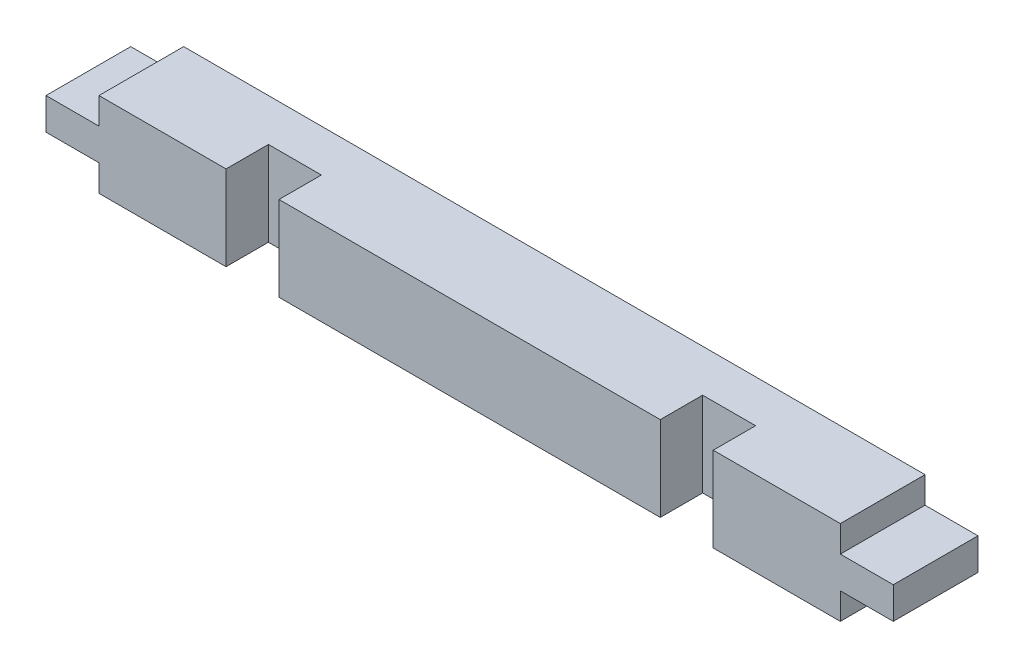
from build123d import *

# Parameters (mm, degrees)
BOSS_EXTRUDE1_DEPTH = 8
SKETCH2_W           = 5
SKETCH2_H           = 8
CUT_EXTRUDE1_DEPTH  = 4


with BuildPart() as part:
    # Sketch1 → Boss-Extrude1 (new body)
    with BuildSketch(Plane.XY):
        Polygon((0, 0), (0, 3), (5, 3), (5, 5.5), (75, 5.5), (75, 3), (80, 3), (80, 0), (75, 0), (75, -2.5), (5, -2.5), (5, 0), align=None)
    extrude(amount=BOSS_EXTRUDE1_DEPTH)

    # Sketch2 → Cut-Extrude1 (cut)
    with BuildSketch(Plane.XY.offset(8)):
        with Locations((19.5, 1.5)):
            Rectangle(SKETCH2_W, SKETCH2_H)
        with Locations((60.5, 1.5)):
            Rectangle(SKETCH2_W, SKETCH2_H)
    extrude(amount=-CUT_EXTRUDE1_DEPTH, mode=Mode.SUBTRACT)


solid = part.part
